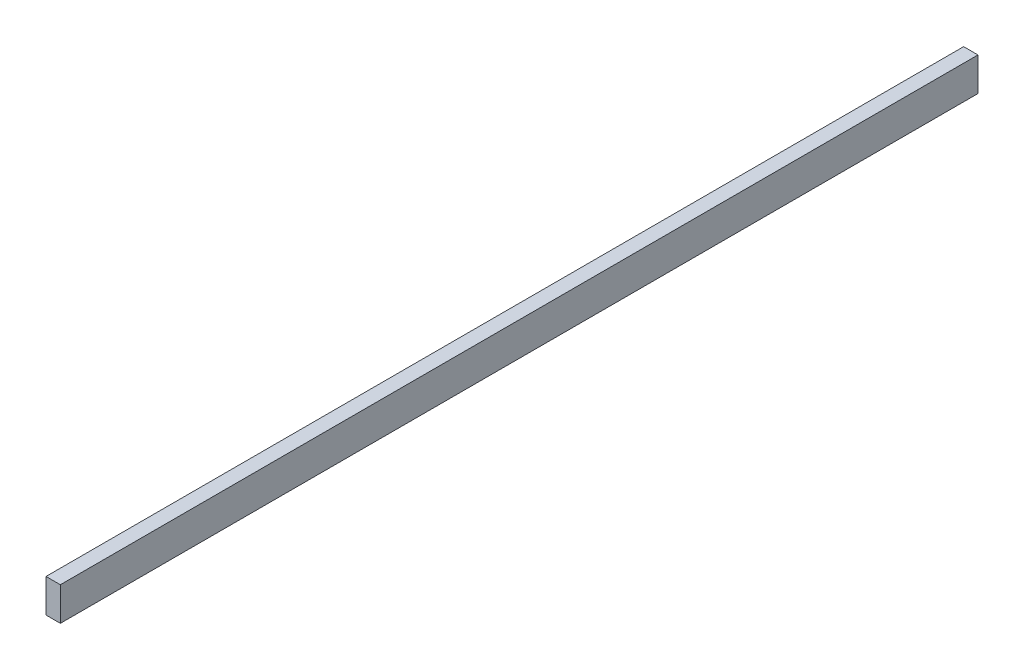
from build123d import *

# Parameters (mm, degrees)
SKETCH1_W      = 38.1
SKETCH1_H      = 88.9
EXTRUDE1_DEPTH = 1219.2


with BuildPart() as part:
    # Sketch1 → Extrude1 (new, symmetric)
    with BuildSketch(Plane.XY):
        Rectangle(SKETCH1_W, SKETCH1_H)
    extrude(amount=EXTRUDE1_DEPTH, both=True)


solid = part.part
